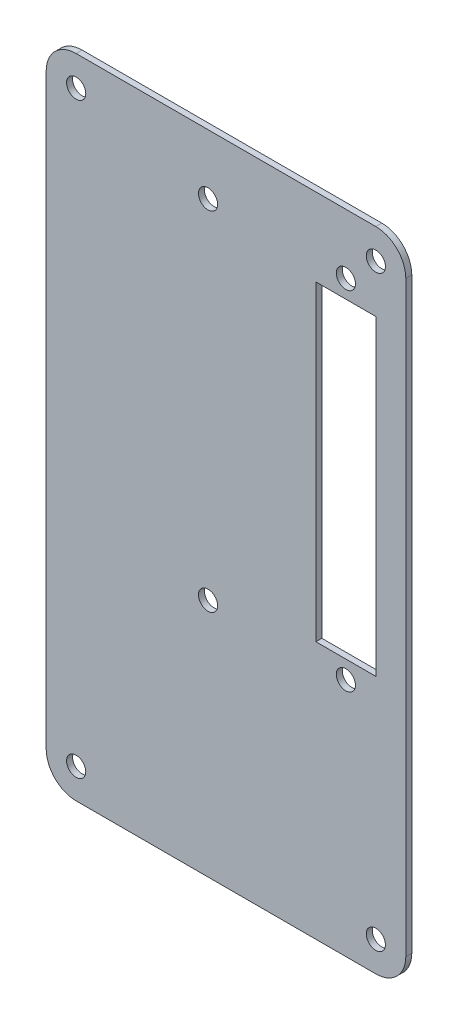
from build123d import *

# Parameters (mm, degrees)
SKETCH_1_W          = 60
SKETCH_1_H          = 108
EXTRUDE_1_DEPTH     = 1
SKETCH_2_R          = 1.6
CUT_EXTRUDE_1_DEPTH = 5
SKETCH_4_R          = 1.6
CUT_EXTRUDE_3_DEPTH = 5
FILLET_1_R          = 5
SKETCH_5_W          = 10
SKETCH_5_H          = 52
CUT_EXTRUDE_4_DEPTH = 62.781874365


with BuildPart() as part:
    # ｽｹｯﾁ1 → ﾎﾞｽ - 押し出し1 (new body)
    with BuildSketch(Plane.XY):
        Rectangle(SKETCH_1_W, SKETCH_1_H)
    extrude(amount=EXTRUDE_1_DEPTH)

    # ｽｹｯﾁ2 → ｶｯﾄ - 押し出し1 (cut)
    with BuildSketch(Plane.XY.offset(1)):
        with Locations((-3, 44)):
            Circle(SKETCH_2_R)
        with Locations((20, 44)):
            Circle(SKETCH_2_R)
        with Locations((-3, -14)):
            Circle(SKETCH_2_R)
        with Locations((20, -14)):
            Circle(SKETCH_2_R)
    extrude(amount=-CUT_EXTRUDE_1_DEPTH, mode=Mode.SUBTRACT)

    # ｽｹｯﾁ4 → ｶｯﾄ - 押し出し3 (cut)
    with BuildSketch(Plane.XY.offset(1)):
        with Locations((-25, 49)):
            Circle(SKETCH_4_R)
        with Locations((25, 49)):
            Circle(SKETCH_4_R)
        with Locations((-25, -49)):
            Circle(SKETCH_4_R)
        with Locations((25, -49)):
            Circle(SKETCH_4_R)
    extrude(amount=-CUT_EXTRUDE_3_DEPTH, mode=Mode.SUBTRACT)

    # ﾌｨﾚｯﾄ1
    fillet_1_edges = [part.edges().sort_by_distance(p)[0] for p in [
        (30, -54, 0.5),
        (-30, -54, 0.5),
        (-30, 54, 0.5),
        (30, 54, 0.5),
    ]]
    fillet(fillet_1_edges, radius=FILLET_1_R)

    # ｽｹｯﾁ5 → ｶｯﾄ - 押し出し4 (cut, through all)
    with BuildSketch(Plane(origin=(0, 0, 0), x_dir=(-1, 0, 0), z_dir=(0, 0, -1))):
        with Locations((-20, 15)):
            Rectangle(SKETCH_5_W, SKETCH_5_H)
    extrude(amount=-CUT_EXTRUDE_4_DEPTH, mode=Mode.SUBTRACT)


solid = part.part
